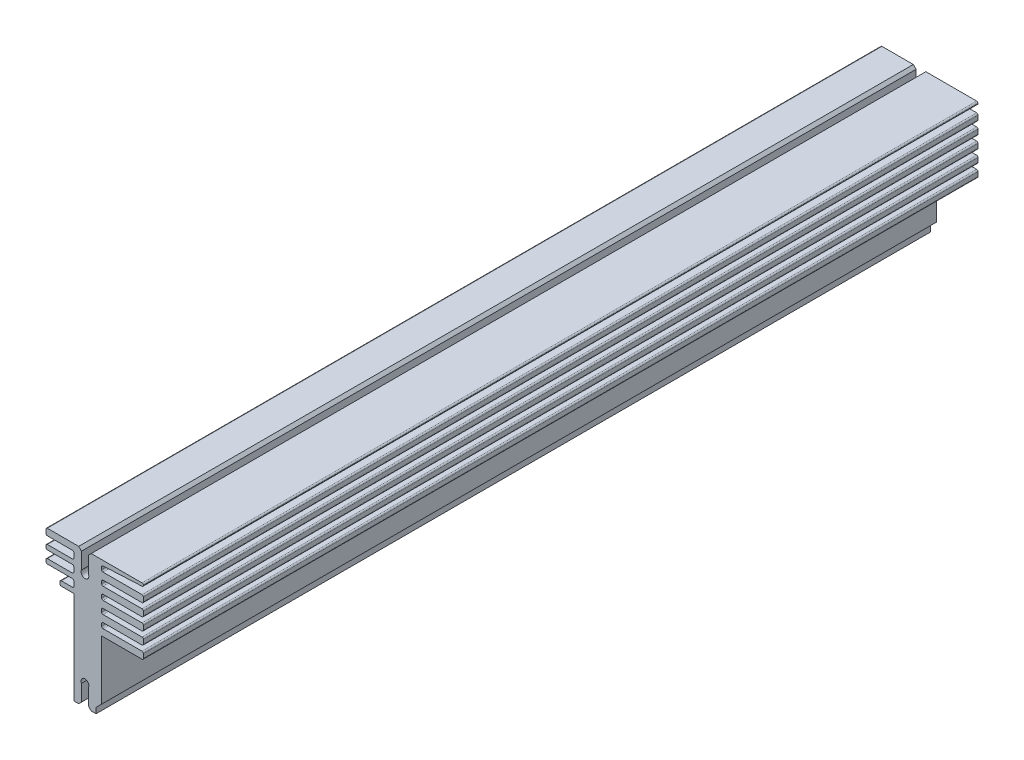
from build123d import *

# Parameters (mm, degrees)
EXTRUDE_1_DEPTH = 299.99673285
CHAMFER_1_SIZE  = 1
CHAMFER_2_SIZE  = 1
FILLET_1_R      = 0.5
FILLET_2_R      = 0.5
FILLET_3_R      = 0.5
FILLET_4_R      = 0.5
FILLET_5_R      = 0.5
FILLET_6_R      = 0.5
FILLET_7_R      = 0.5
CHAMFER_4_SIZE  = 1
CHAMFER_5_SIZE  = 1


with BuildPart() as part:
    # Эскиз1 → Бобышка-Вытянуть1 (new body)
    with BuildSketch(Plane.XY):
        with BuildLine():
            Line((-1.25, 0), (-1.25, 6.869523989))
            ThreePointArc((-1.25, 6.869523989), (0, 8.9), (1.25, 6.869523989))
            Line((1.25, 6.869523989), (1.25, 0))
            Line((1.25, 0), (4, 0))
            Line((4, 0), (4, 2))
            Line((4, 2), (6, 4))
            Line((6, 4), (6, 25.25))
            Line((6, 25.25), (21, 25.25))
            Line((21, 25.25), (21, 27.75))
            Line((21, 27.75), (6, 27.75))
            Line((6, 27.75), (6, 29.65))
            Line((6, 29.65), (21, 29.65))
            Line((21, 29.65), (21, 32.15))
            Line((21, 32.15), (6, 32.15))
            Line((6, 32.15), (6, 34.05))
            Line((6, 34.05), (21, 34.05))
            Line((21, 34.05), (21, 36.55))
            Line((21, 36.55), (6, 36.55))
            Line((6, 36.55), (6, 38.45))
            Line((6, 38.45), (21, 38.45))
            Line((21, 38.45), (21, 40.95))
            Line((21, 40.95), (6, 40.95))
            Line((6, 40.95), (6, 42.85))
            Line((6, 42.85), (21, 42.85))
            Line((21, 42.85), (21, 45.35))
            Line((21, 45.35), (6, 45.35))
            Line((6, 45.35), (6, 47.25))
            Line((6, 47.25), (21, 48))
            Line((21, 48), (21, 49))
            Line((21, 49), (1.25, 49))
            Line((1.25, 49), (1.25, 42.116940633))
            ThreePointArc((1.25, 42.116940633), (0, 40.106043134), (-1.25, 42.116940633))
            Line((-1.25, 42.116940633), (-1.25, 49))
            Line((-1.25, 49), (-14, 49))
            Line((-14, 49), (-14, 46.65))
            Line((-14, 46.65), (-4, 46.65))
            Line((-4, 46.65), (-4, 43.95))
            Line((-4, 43.95), (-14, 43.95))
            Line((-14, 43.95), (-14, 42.25))
            Line((-14, 42.25), (-4, 42.25))
            Line((-4, 42.25), (-4, 39.55))
            Line((-4, 39.55), (-14, 39.55))
            Line((-14, 39.55), (-14, 37.85))
            Line((-14, 37.85), (-4, 37.85))
            Line((-4, 37.85), (-4, 35.15))
            Line((-4, 35.15), (-9, 35.15))
            Line((-9, 35.15), (-9, 33.45))
            Line((-9, 33.45), (-4, 33.45))
            Line((-4, 33.45), (-4, 0))
            Line((-4, 0), (-1.25, 0))
        make_face()
    extrude(amount=EXTRUDE_1_DEPTH)

    # Фаска1
    chamfer_1_edges = [part.edges().sort_by_distance(p)[0] for p in [
        (-1.25, 0, 149.998366425),
    ]]
    chamfer(chamfer_1_edges, length=CHAMFER_1_SIZE)

    # Фаска2
    chamfer_2_edges = [part.edges().sort_by_distance(p)[0] for p in [
        (1.25, 0, 149.998366425),
    ]]
    chamfer(chamfer_2_edges, length=CHAMFER_2_SIZE)

    # Скругление1
    fillet_1_edges = [part.edges().sort_by_distance(p)[0] for p in [
        (-9, 33.45, 149.998366425),
        (-9, 35.15, 149.998366425),
        (-14, 37.85, 149.998366425),
        (-14, 39.55, 149.998366425),
        (-14, 42.25, 149.998366425),
        (-14, 43.95, 149.998366425),
        (-14, 46.65, 149.998366425),
    ]]
    fillet(fillet_1_edges, radius=FILLET_1_R)

    # Скругление2
    fillet_2_edges = [part.edges().sort_by_distance(p)[0] for p in [
        (-4, 35.15, 149.998366425),
        (-4, 39.55, 149.998366425),
        (-4, 43.95, 149.998366425),
    ]]
    fillet(fillet_2_edges, radius=FILLET_2_R)

    # Скругление3
    fillet_3_edges = [part.edges().sort_by_distance(p)[0] for p in [
        (-4, 37.85, 149.998366425),
        (-4, 42.25, 149.998366425),
        (-4, 46.65, 149.998366425),
    ]]
    fillet(fillet_3_edges, radius=FILLET_3_R)

    # Скругление4
    fillet_4_edges = [part.edges().sort_by_distance(p)[0] for p in [
        (-14, 49, 149.998366425),
    ]]
    fillet(fillet_4_edges, radius=FILLET_4_R)

    # Скругление5
    fillet_5_edges = [part.edges().sort_by_distance(p)[0] for p in [
        (21, 49, 149.998366425),
        (21, 48, 149.998366425),
        (21, 45.35, 149.998366425),
        (21, 42.85, 149.998366425),
        (21, 40.95, 149.998366425),
        (21, 38.45, 149.998366425),
        (21, 36.55, 149.998366425),
        (21, 34.05, 149.998366425),
        (21, 32.15, 149.998366425),
        (21, 29.65, 149.998366425),
        (21, 27.75, 149.998366425),
        (21, 25.25, 149.998366425),
    ]]
    fillet(fillet_5_edges, radius=FILLET_5_R)

    # Скругление6
    fillet_6_edges = [part.edges().sort_by_distance(p)[0] for p in [
        (6, 47.25, 149.998366425),
        (6, 42.85, 149.998366425),
        (6, 38.45, 149.998366425),
        (6, 34.05, 149.998366425),
        (6, 29.65, 149.998366425),
    ]]
    fillet(fillet_6_edges, radius=FILLET_6_R)

    # Скругление7
    fillet_7_edges = [part.edges().sort_by_distance(p)[0] for p in [
        (6, 45.35, 149.998366425),
        (6, 40.95, 149.998366425),
        (6, 36.55, 149.998366425),
        (6, 32.15, 149.998366425),
        (6, 27.75, 149.998366425),
    ]]
    fillet(fillet_7_edges, radius=FILLET_7_R)

    # Фаска4
    chamfer_4_edges = [part.edges().sort_by_distance(p)[0] for p in [
        (-1.25, 49, 149.998366425),
    ]]
    chamfer(chamfer_4_edges, length=CHAMFER_4_SIZE)

    # Фаска5
    chamfer_5_edges = [part.edges().sort_by_distance(p)[0] for p in [
        (1.25, 49, 149.998366425),
    ]]
    chamfer(chamfer_5_edges, length=CHAMFER_5_SIZE)


solid = part.part
